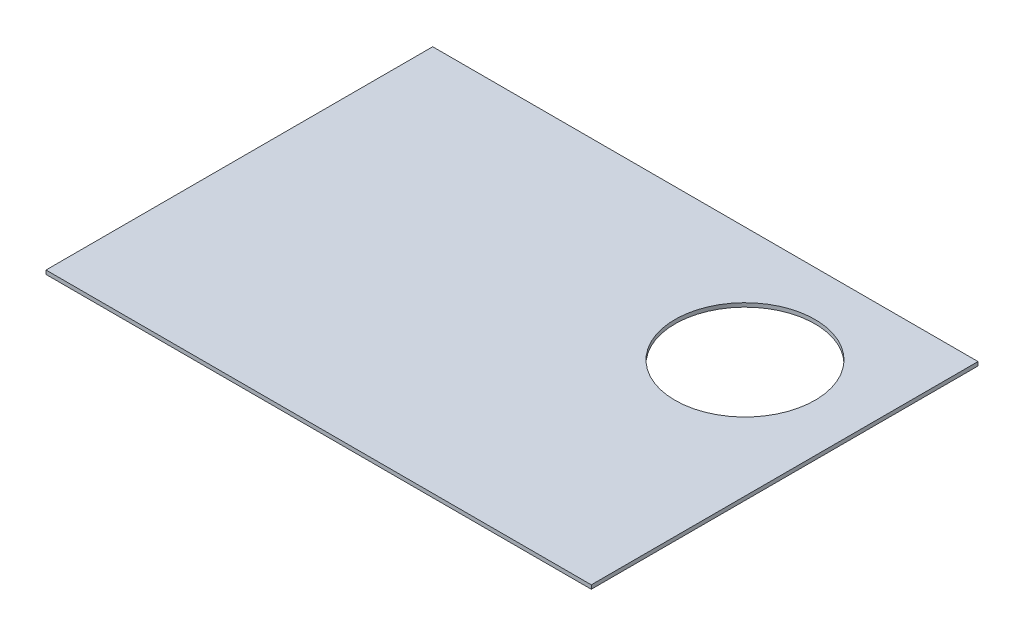
from build123d import *

# Parameters (mm, degrees)
BOSS_EXTRUDE1_DEPTH = 3.175
SKETCH5_R           = 57.5
CUT_EXTRUDE4_DEPTH  = 549.843544419


with BuildPart() as part:
    # Sketch1 → Boss-Extrude1 (new body)
    with BuildSketch(Plane(origin=(0, 0, 0), x_dir=(1, 0, 0), z_dir=(0, 1, 0))):
        Polygon((401.6375, 0), (447.675, 0), (447.675, 317.5), (0, 317.5), (0, 0), (46.0375, 0), align=None)
    extrude(amount=BOSS_EXTRUDE1_DEPTH)

    # Sketch5 → Cut-Extrude4 (cut, through all)
    with BuildSketch(Plane(origin=(0, 3.175, 0), x_dir=(1, 0, 0), z_dir=(0, 1, 0))):
        with Locations(Location((350.8375, 223.04375, 0), (0, 0, 270))):
            Circle(SKETCH5_R)
    extrude(amount=-CUT_EXTRUDE4_DEPTH, mode=Mode.SUBTRACT)


solid = part.part
